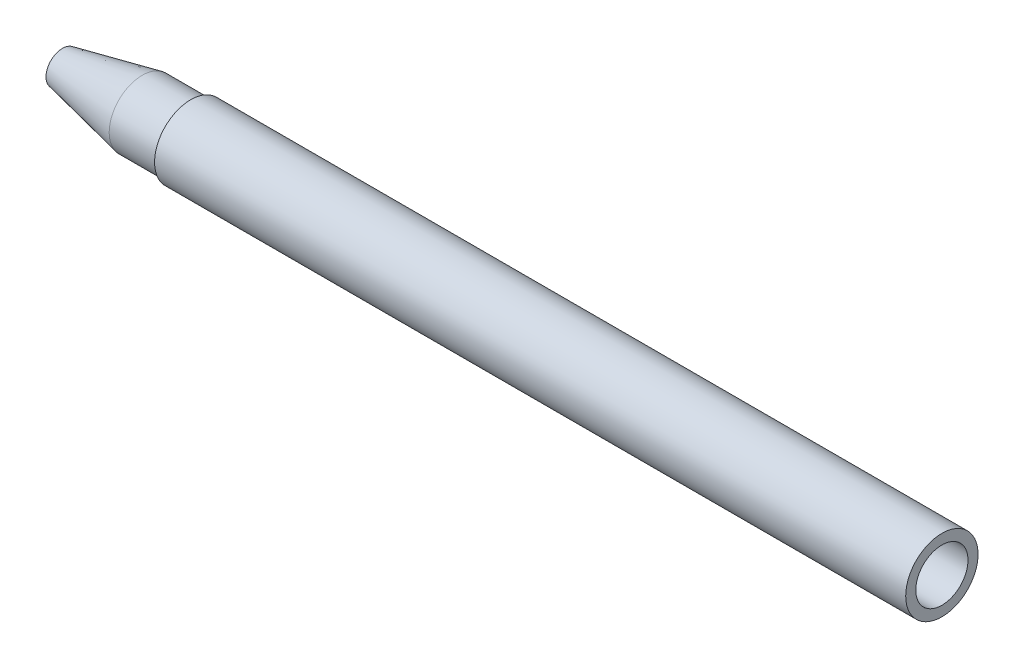
from build123d import *


with BuildPart() as part:
    # Sketch1 → Revolve1 (revolve)
    with BuildSketch(Plane.XY, mode=Mode.PRIVATE) as revolve1_sk:
        Polygon((-51.9, 0), (51.9, 0), (51.9, -1.39), (-58.6, -1.39), (-69.63, -3.69), (-69.63, -2.73), (-58.6, -0.43), (-51.9, -0.43), align=None)
    revolve(revolve1_sk.sketch.rotate(Axis((-81.236098172, -5, 0), (1, 0, 0)), 90), axis=Axis((-81.236098172, -5, 0), (1, 0, 0)))


solid = part.part
